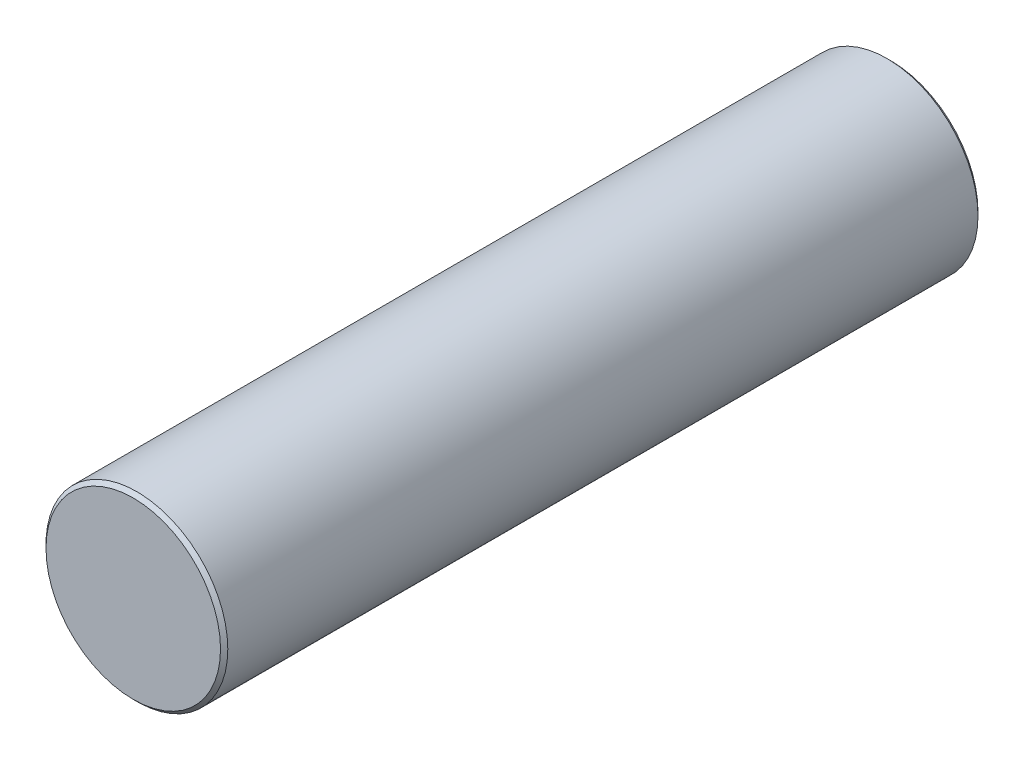
from build123d import *

# Parameters (mm, degrees)
BOSS_EXTRUDE1_DEPTH      = 12.5
BOSS_EXTRUDE1_DEPTH_BACK = 12.5
SKETCH2_R                = 3
CHAMFER1_SIZE            = 0.12


with BuildPart() as part:
    # Sketch2 → Boss-Extrude1 (new, two sides: drawn at the far end of the back side and taken through both)
    with BuildSketch(Plane.XY.offset(-BOSS_EXTRUDE1_DEPTH_BACK)):
        Circle(SKETCH2_R)
    extrude(amount=BOSS_EXTRUDE1_DEPTH + BOSS_EXTRUDE1_DEPTH_BACK)

    # Chamfer1
    chamfer1_edges = [part.edges().sort_by_distance(p)[0] for p in [
        (-3, 0, -12.5),
        (-3, 0, 12.5),
    ]]
    chamfer(chamfer1_edges, length=CHAMFER1_SIZE)


solid = part.part
